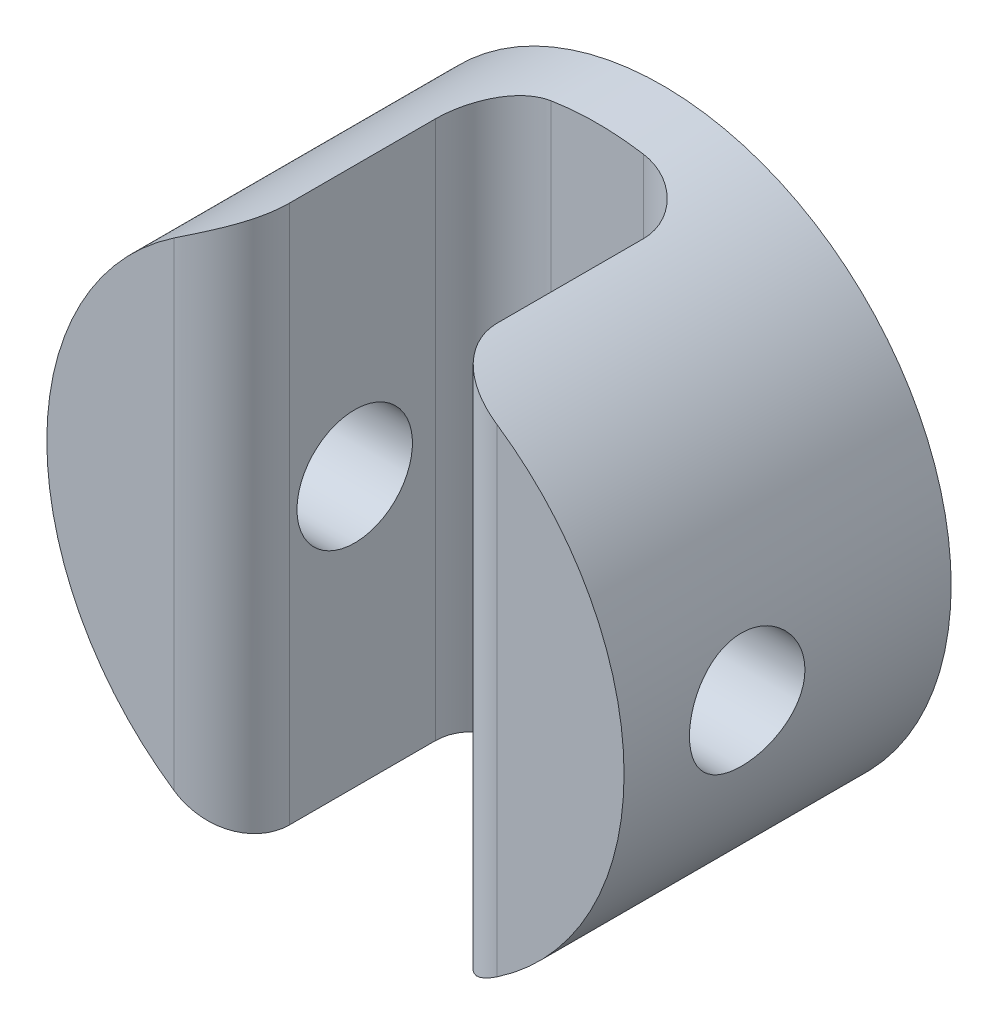
from build123d import *

# Parameters (mm, degrees)
SKETCH1_R               = 7.5
BOSS_EXTRUDE1_DEPTH     = 8.5
CUT_EXTRUDE1_DEPTH      = 6.8
CUT_EXTRUDE2_DEPTH      = 16.249262277
CUT_EXTRUDE2_DEPTH_BACK = 16.249262277
SKETCH3_R               = 1.5
FILLET1_R               = 1.5


with BuildPart() as part:
    # Sketch1 → Boss-Extrude1 (new body)
    with BuildSketch(Plane.XY):
        Circle(SKETCH1_R)
    extrude(amount=BOSS_EXTRUDE1_DEPTH)

    # Sketch2 → Cut-Extrude1 (cut)
    with BuildSketch(Plane.XY.offset(8.5)):
        Polygon((2.7, 0), (2.7, 13.78279584), (-2.7, 13.78279584), (-2.7, 0), (-2.7, -14.12853377), (2.7, -14.12853377), align=None)
    extrude(amount=-CUT_EXTRUDE1_DEPTH, mode=Mode.SUBTRACT)

    # Sketch3 → Cut-Extrude2 (cut, two sides: drawn at the far end of the back side and taken through both)
    with BuildSketch(Plane(origin=(-2.7, 0, 0), x_dir=(0, 0, -1), z_dir=(1, 0, 0)).offset(-CUT_EXTRUDE2_DEPTH_BACK)):
        with Locations(Location((-5.3, 0, 0), (0, 0, 180))):
            Circle(SKETCH3_R)
    extrude(amount=CUT_EXTRUDE2_DEPTH + CUT_EXTRUDE2_DEPTH_BACK, mode=Mode.SUBTRACT)

    # Fillet1
    fillet1_edges = [part.edges().sort_by_distance(p)[0] for p in [
        (-2.7, 0, 1.7),
        (2.7, 0, 1.7),
        (2.7, 0, 8.5),
        (-2.7, 0, 8.5),
    ]]
    fillet(fillet1_edges, radius=FILLET1_R)


solid = part.part
